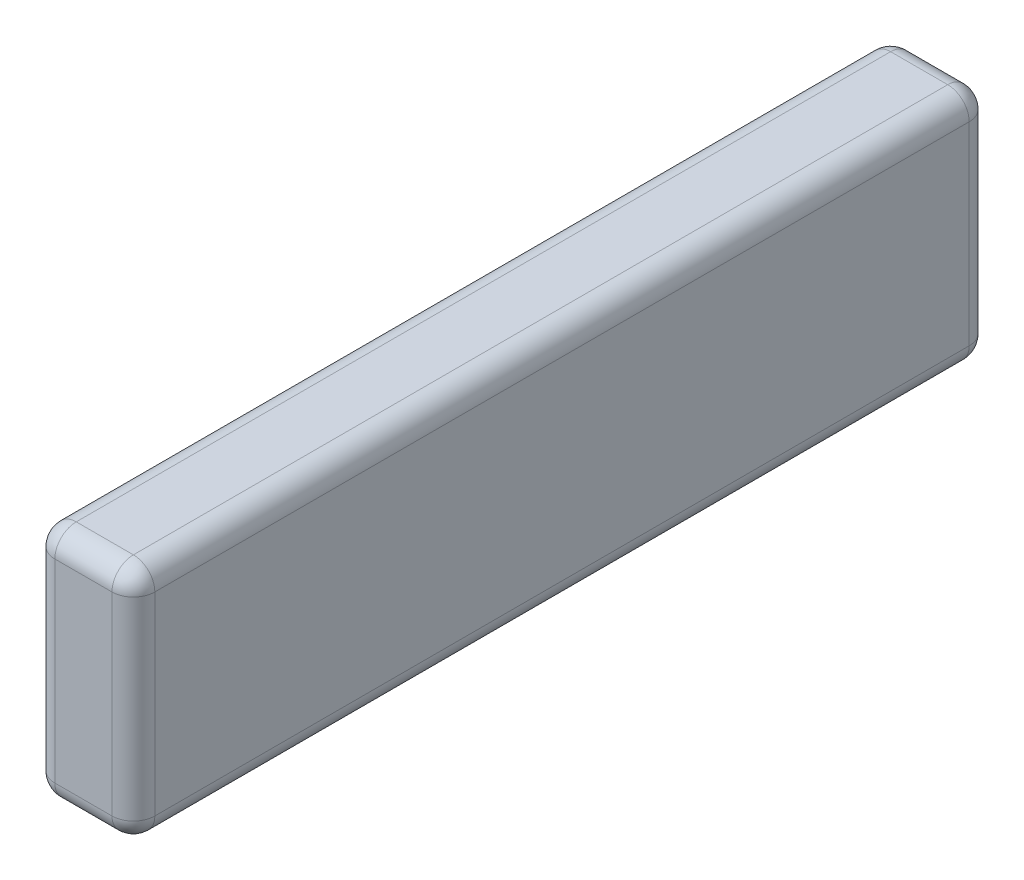
from build123d import *

# Parameters (mm, degrees)
SKETCH1_W           = 1200
SKETCH1_H           = 331.6
BOSS_EXTRUDE1_DEPTH = 140
FILLET1_R           = 30


with BuildPart() as part:
    # Sketch1 → Boss-Extrude1 (new body)
    with BuildSketch(Plane(origin=(0, 0, 0), x_dir=(0, 0, -1), z_dir=(1, 0, 0))):
        Rectangle(SKETCH1_W, SKETCH1_H)
    extrude(amount=BOSS_EXTRUDE1_DEPTH)

    # Fillet1
    fillet1_edges = [part.edges().sort_by_distance(p)[0] for p in [
        (140, 0, -600),
        (140, 165.8, 0),
        (140, 0, 600),
        (0, 165.8, 0),
        (0, 0, -600),
        (0, -165.8, 0),
        (0, 0, 600),
        (70, 165.8, 600),
        (70, 165.8, -600),
        (70, -165.8, -600),
        (70, -165.8, 600),
        (140, -165.8, 0),
    ]]
    fillet(fillet1_edges, radius=FILLET1_R)


solid = part.part
